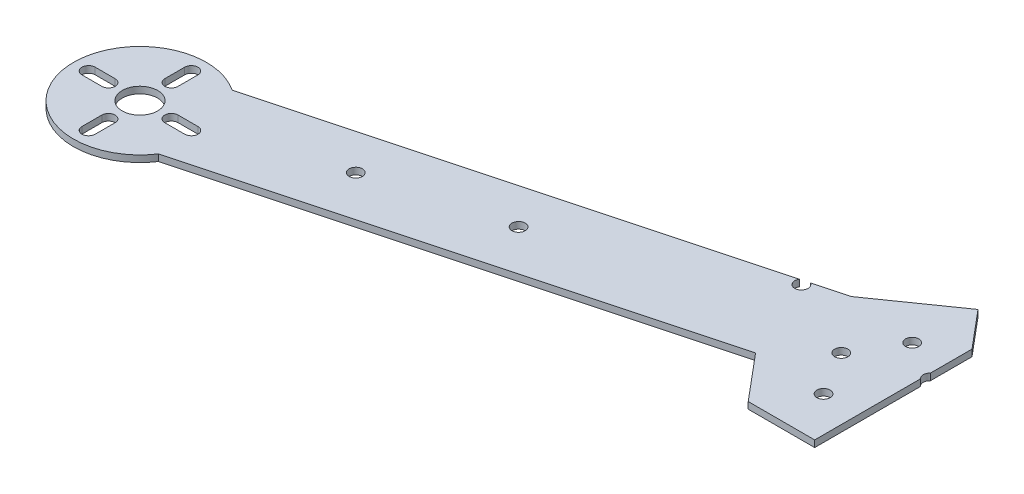
from build123d import *

# Parameters (mm, degrees)
SKETCH2_R           = 4
SKETCH2_R_2         = 1.5
BOSS_EXTRUDE1_DEPTH = 1.5
SKETCH6_R           = 1.5
CUT_EXTRUDE1_DEPTH  = 1.5
SKETCH7_R           = 1.5
CUT_EXTRUDE2_DEPTH  = 1.5


with BuildPart() as part:
    # Sketch2 → Boss-Extrude1 (new body)
    with BuildSketch(Plane(origin=(0, 0, 0), x_dir=(1, 0, 0), z_dir=(0, 1, 0))):
        with BuildLine():
            Line((0, -35.261127532), (0, -44.643093543))
            ThreePointArc((0, -44.643093543), (-0.5, -45.761127532), (0, -46.879161521))
            Line((0, -46.879161521), (0, -70.761127532))
            Line((0, -70.761127532), (-15, -70.761127532))
            Line((-15, -70.761127532), (-23.677632731, -60.41952755))
            Line((-23.677632731, -60.41952755), (-129.929473623, -88.889622511))
            ThreePointArc((-129.929473623, -88.889622511), (-157.136079306, -83.55030532), (-134.097880355, -68.124706791))
            Line((-134.097880355, -68.124706791), (-23.863280614, -38.592955603))
            Line((-23.863280614, -38.592955603), (-7.070663707, -26.834638658))
            Line((-7.070663707, -26.834638658), (0, -35.261127532))
        make_face()
        with Locations(Location((-142.429473623, -80.598060535, 0), (0, 0, 270))):
            Circle(SKETCH2_R, mode=Mode.SUBTRACT)
        with Locations(Location((-8, -60.761127532, 0), (0, 0, 270))):
            Circle(SKETCH2_R_2, mode=Mode.SUBTRACT)
        with Locations(Location((-14, -50.761127532, 0), (0, 0, 270))):
            Circle(SKETCH2_R_2, mode=Mode.SUBTRACT)
        with Locations(Location((-8, -40.761127532, 0), (0, 0, 270))):
            Circle(SKETCH2_R_2, mode=Mode.SUBTRACT)
        with BuildLine():
            Line((-135.329473623, -79.098060535), (-130.829473623, -79.098060535))
            ThreePointArc((-130.829473623, -79.098060535), (-129.329473623, -80.598060535), (-130.829473623, -82.098060535))
            Line((-130.829473623, -82.098060535), (-135.329473623, -82.098060535))
            ThreePointArc((-135.329473623, -82.098060535), (-136.829473623, -80.598060535), (-135.329473623, -79.098060535))
        make_face(mode=Mode.SUBTRACT)
        with BuildLine():
            Line((-140.929473623, -87.698060535), (-140.929473623, -92.198060535))
            ThreePointArc((-140.929473623, -92.198060535), (-142.429473623, -93.698060535), (-143.929473623, -92.198060535))
            Line((-143.929473623, -92.198060535), (-143.929473623, -87.698060535))
            ThreePointArc((-143.929473623, -87.698060535), (-142.429473623, -86.198060535), (-140.929473623, -87.698060535))
        make_face(mode=Mode.SUBTRACT)
        with BuildLine():
            Line((-149.529473623, -82.098060535), (-154.029473623, -82.098060535))
            ThreePointArc((-154.029473623, -82.098060535), (-155.529473623, -80.598060535), (-154.029473623, -79.098060535))
            Line((-154.029473623, -79.098060535), (-149.529473623, -79.098060535))
            ThreePointArc((-149.529473623, -79.098060535), (-148.029473623, -80.598060535), (-149.529473623, -82.098060535))
        make_face(mode=Mode.SUBTRACT)
        with BuildLine():
            Line((-143.929473623, -73.498060535), (-143.929473623, -68.998060535))
            ThreePointArc((-143.929473623, -68.998060535), (-142.429473623, -67.498060535), (-140.929473623, -68.998060535))
            Line((-140.929473623, -68.998060535), (-140.929473623, -73.498060535))
            ThreePointArc((-140.929473623, -73.498060535), (-142.429473623, -74.998060535), (-143.929473623, -73.498060535))
        make_face(mode=Mode.SUBTRACT)
    extrude(amount=BOSS_EXTRUDE1_DEPTH)

    # Sketch6 → Cut-Extrude1 (cut)
    with BuildSketch(Plane(origin=(0, 1.5, 0), x_dir=(1, 0, 0), z_dir=(0, 1, 0))):
        with Locations((-31.86, -41.901127532)):
            Circle(SKETCH6_R)
    extrude(amount=-CUT_EXTRUDE1_DEPTH, mode=Mode.SUBTRACT)

    # Sketch7 → Cut-Extrude2 (cut)
    with BuildSketch(Plane(origin=(0, 1.5, 0), x_dir=(1, 0, 0), z_dir=(0, 1, 0))):
        with Locations(Location((-104.014122572, -70.306622169, 0), (0, 0, 270))):
            Circle(SKETCH7_R)
        with Locations(Location((-75.035984993, -62.543404895, 0), (0, 0, 270))):
            Circle(SKETCH7_R)
    extrude(amount=-CUT_EXTRUDE2_DEPTH, mode=Mode.SUBTRACT)


solid = part.part
